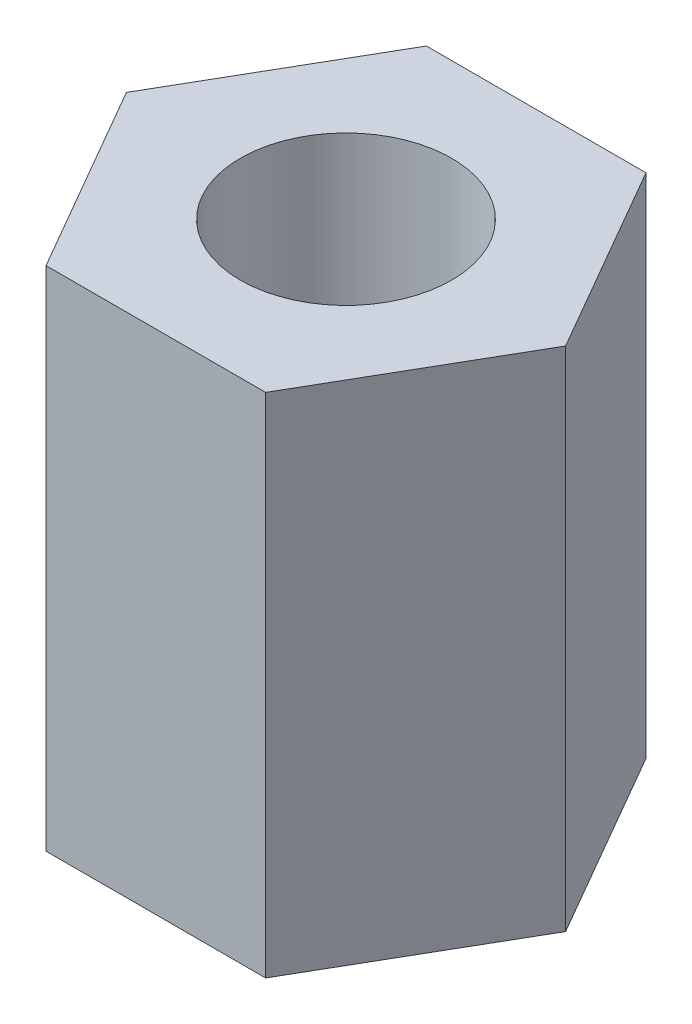
from build123d import *

# Parameters (mm, degrees)
SKETCH_1_R      = 1.25
EXTRUDE_1_DEPTH = 6


with BuildPart() as part:
    # 草图1 → 凸台-拉伸1 (new body)
    with BuildSketch(Plane(origin=(0, 0, 0), x_dir=(1, 0, 0), z_dir=(0, 1, 0))):
        Polygon((1.299038106, -2.25), (2.598076211, 0), (1.299038106, 2.25), (-1.299038106, 2.25), (-2.598076211, 0), (-1.299038106, -2.25), align=None)
        with Locations(Location((0, 0, 0), (0, 0, 270))):
            Circle(SKETCH_1_R, mode=Mode.SUBTRACT)
    extrude(amount=EXTRUDE_1_DEPTH)


solid = part.part
